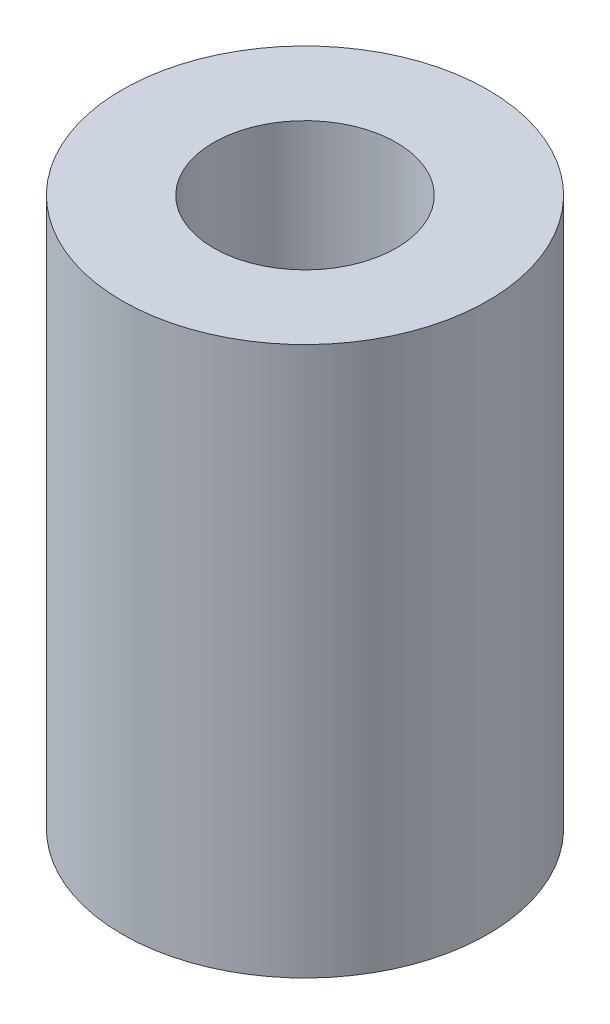
from build123d import *

# Parameters (mm, degrees)
SKETCH_1_R      = 5
SKETCH_1_R_2    = 2.5
EXTRUDE_1_DEPTH = 15
SCALE_1_SCALE   = 0.6


with BuildPart() as part:
    # 草图1 → 凸台-拉伸1 (new body)
    with BuildSketch(Plane(origin=(0, 0, 0), x_dir=(1, 0, 0), z_dir=(0, 1, 0))):
        with Locations(Location((0, 0, 0), (0, 0, 270))):
            Circle(SKETCH_1_R)
        with Locations(Location((0, 0, 0), (0, 0, 270))):
            Circle(SKETCH_1_R_2, mode=Mode.SUBTRACT)
    extrude(amount=EXTRUDE_1_DEPTH)


with BuildPart() as part_1:
    # 缩放比例1: scaled about (0, 0, 0)
    add(part.part.scale(SCALE_1_SCALE))


solid = part_1.part
